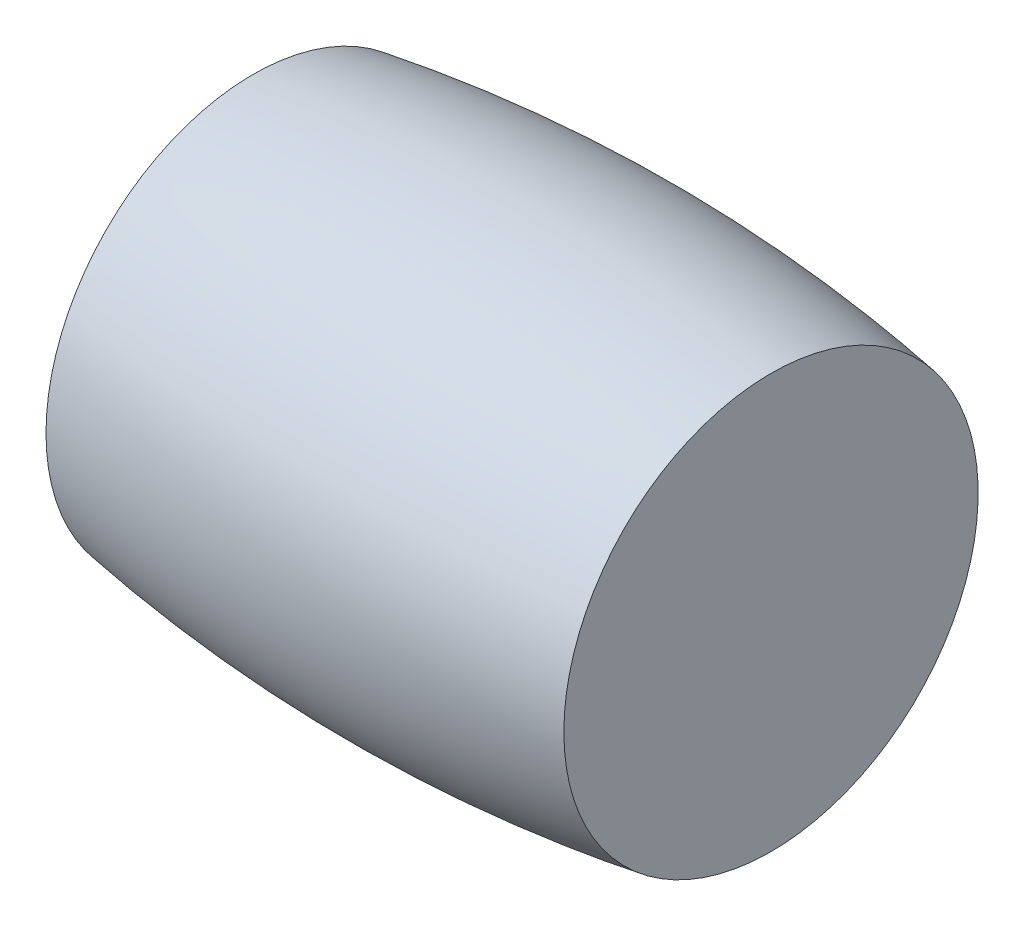
from build123d import *


with BuildPart() as part:
    # Sketch1 → Revolve1 (revolve)
    with BuildSketch(Plane.XY):
        with BuildLine():
            Line((-7.5, 0), (-7.5, 6))
            ThreePointArc((-7.5, 6), (0, 6.6), (7.5, 6))
            Line((7.5, 6), (7.5, 0))
            Line((7.5, 0), (-7.5, 0))
        make_face()
    revolve(axis=Axis((-7.5, 0, 0), (1, 0, 0)))


solid = part.part
